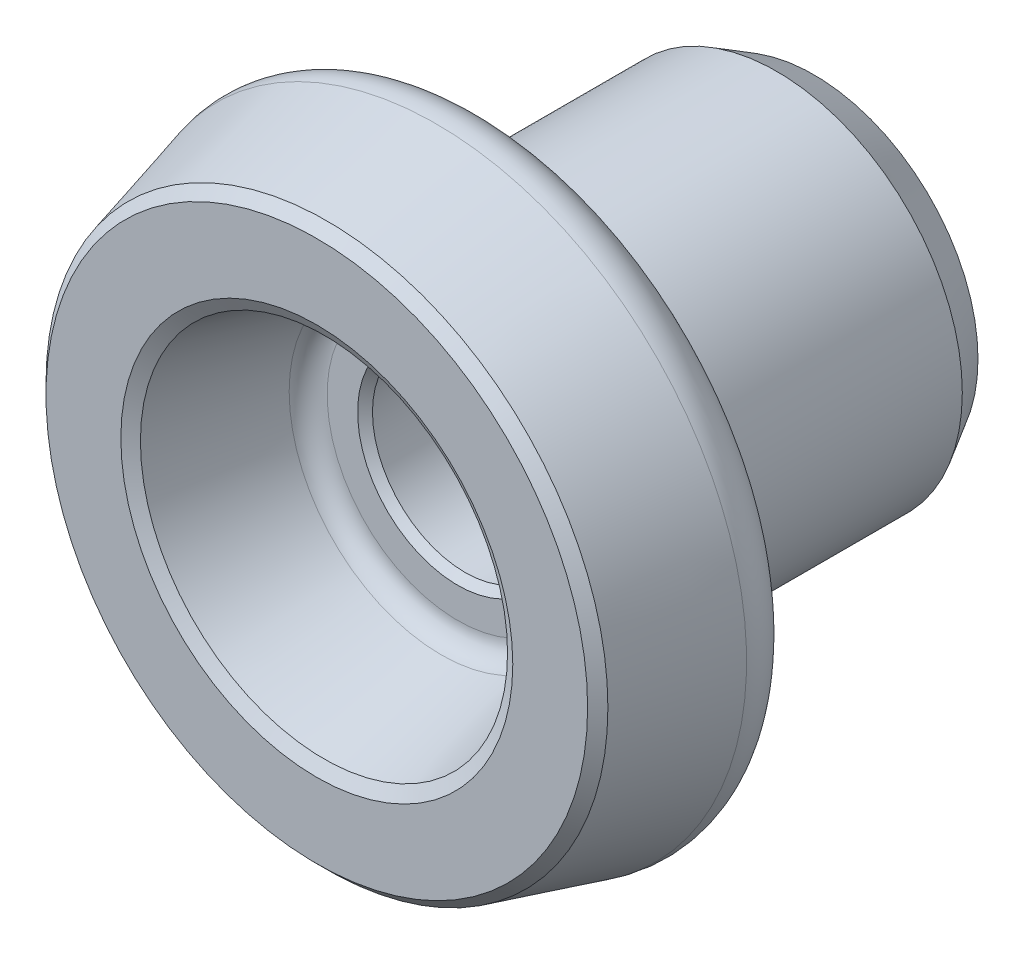
from build123d import *
from OCP.BRepFilletAPI import BRepFilletAPI_MakeChamfer

# Parameters (mm, degrees)
CHAMFER2_SIZE  = 1
CHAMFER3_SIZE  = 0.5
CHAMFER3_SIZE2 = 0.707106781
FILLET2_R      = 1.5
FILLET3_R      = 2.5


with BuildPart() as part:
    # Sketch1 → Revolve1 (revolve)
    with BuildSketch(Plane(origin=(0, 0, 0), x_dir=(0, 0, -1), z_dir=(1, 0, 0)), mode=Mode.PRIVATE) as revolve1_sk:
        with BuildLine():
            Line((0, 12.5), (0, 18.75))
            Line((0, 18.75), (8.055257976, 20.90839987))
            ThreePointArc((8.055257976, 20.90839987), (10.028187494, 20.648658771), (11.239594642, 19.069922238))
            Line((11.239594642, 19.069922238), (13, 12.5))
            Line((13, 12.5), (31, 12.5))
            Line((31, 12.5), (33.5, 11.056624327))
            Line((33.5, 11.056624327), (33.5, 6.25))
            Line((33.5, 6.25), (9.5, 6.25))
            Line((9.5, 6.25), (9.5, 9.954482672))
            Line((9.5, 9.954482672), (0, 12.5))
        make_face()
    revolve(revolve1_sk.sketch.rotate(Axis((0, 0, 0), (0, 0, 1)), 90), axis=Axis((0, 0, 0), (0, 0, 1)))

    # Chamfer2
    chamfer2_edges = [part.edges().sort_by_distance(p)[0] for p in [
        (6.25, 0, -33.5),
    ]]
    chamfer(chamfer2_edges, length=CHAMFER2_SIZE)

    # Chamfer3: one chamfer whose edges measure the first distance from different faces: ONE call of the kernel's chamfer builder (chamfer() names one face for all edges)
    chamfer3_edges_1 = [part.edges().sort_by_distance(p)[0] for p in [
        (12.5, 0, 0),
    ]]
    chamfer3_side_1 = [part.faces().sort_by_distance(p)[0] for p in [
        (11.227241336, 0, -4.75),
    ]]
    chamfer3_edges_2 = [part.edges().sort_by_distance(p)[0] for p in [
        (18.75, 0, 0),
    ]]
    chamfer3_side_2 = [part.faces().sort_by_distance(p)[0] for p in [
        (13.030330086, 0, 0),
    ]]
    chamfer3_edges_3 = [part.edges().sort_by_distance(p)[0] for p in [
        (6.25, 0, -9.5),
    ]]
    chamfer3 = BRepFilletAPI_MakeChamfer(part.part.solid().wrapped)
    for e in chamfer3_edges_1:
        chamfer3.Add(CHAMFER3_SIZE, CHAMFER3_SIZE2, e.wrapped, chamfer3_side_1[0].wrapped)  # the first distance lies on this face
    for e in chamfer3_edges_2:
        chamfer3.Add(CHAMFER3_SIZE, CHAMFER3_SIZE2, e.wrapped, chamfer3_side_2[0].wrapped)  # the first distance lies on this face
    for e in chamfer3_edges_3:
        chamfer3.Add(CHAMFER3_SIZE, e.wrapped)
    add(Compound.cast(chamfer3.Shape()), mode=Mode.REPLACE)

    # Fillet2
    fillet2_edges = [part.edges().sort_by_distance(p)[0] for p in [
        (9.954482672, 0, -9.5),
    ]]
    fillet(fillet2_edges, radius=FILLET2_R)

    # Fillet3
    fillet3_edges = [part.edges().sort_by_distance(p)[0] for p in [
        (12.5, 0, -13),
    ]]
    fillet(fillet3_edges, radius=FILLET3_R)


solid = part.part
